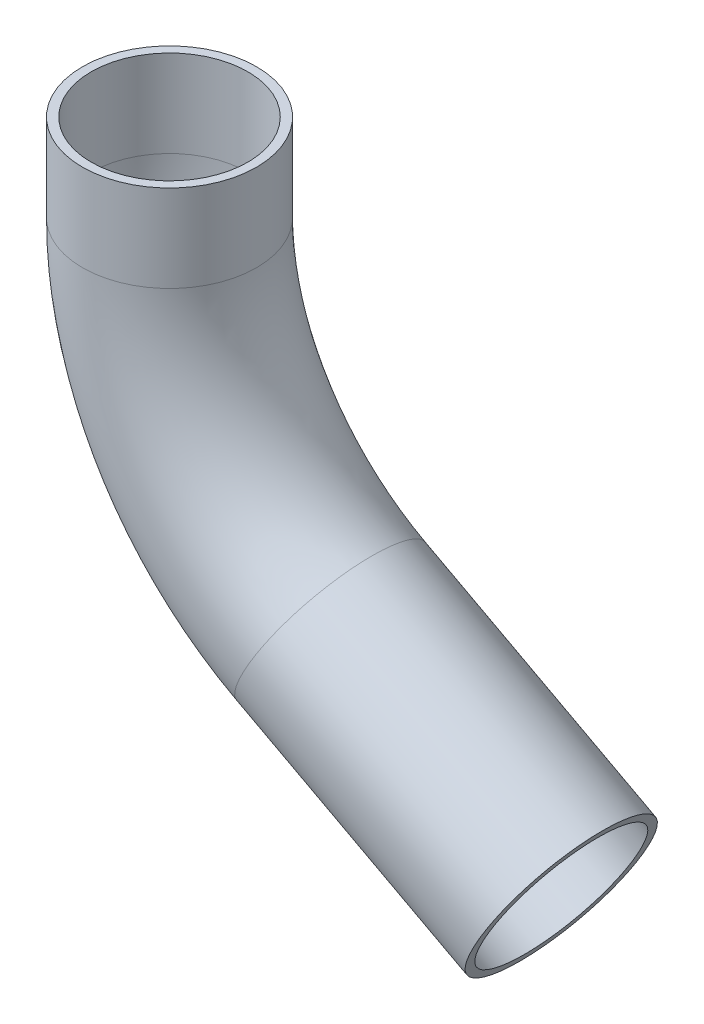
from build123d import *

# Parameters (mm, degrees)
SKETCH1_R   = 10
SKETCH1_R_2 = 9


with BuildPart() as part:
    # Sweep1: sweep along a path in Sketch2
    with BuildLine(Plane.XY) as sweep1_path:
        Line((0, 0), (0, -10))
        ThreePointArc((0, -10), (4.9877476, -28.00735144), (18.529411765, -40.882352941))
        Line((18.529411765, -40.882352941), (45, -55))
    # Sketch1 → Sweep1 (sweep)
    with BuildSketch(Plane(origin=(0, 0, 0), x_dir=(1, 0, 0), z_dir=(0, 1, 0))):
        Circle(SKETCH1_R)
        Circle(SKETCH1_R_2, mode=Mode.SUBTRACT)
    sweep(path=sweep1_path.line)


solid = part.part
